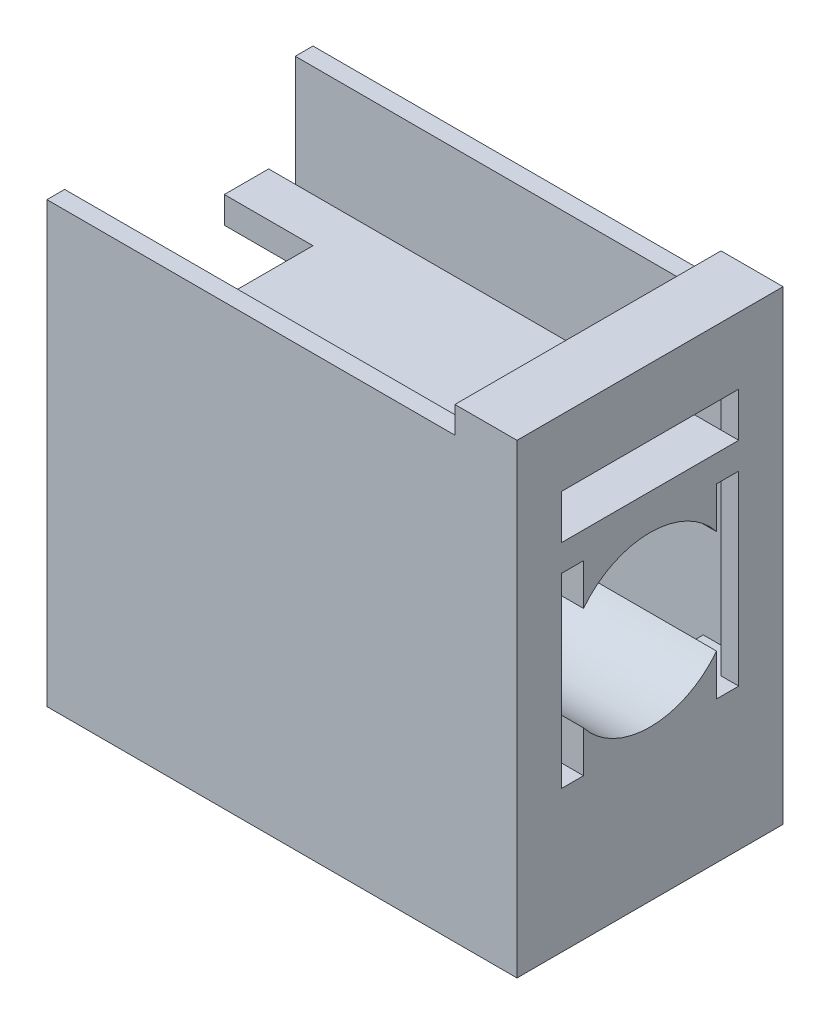
from build123d import *

# Parameters (mm, degrees)
SKETCH1_W            = 51
SKETCH1_H            = 2
SKETCH1_W_2          = 2
BOSS_EXTRUDE1_DEPTH  = 12.5
BOSS_EXTRUDE2_DEPTH  = 3
SKETCH3_W            = 20
SKETCH3_H            = 5
CUT_EXTRUDE1_DEPTH   = 3
SKETCH4_W            = 7
SKETCH4_H            = 30
BOSS_EXTRUDE3_DEPTH  = 3
SKETCH5_W            = 20
SKETCH5_H            = 22
SKETCH5_W_2          = 18
SKETCH5_H_2          = 20
BOSS_EXTRUDE4_DEPTH  = 43
SKETCH6_R            = 1.25
BOSS_EXTRUDE5_DEPTH  = 4.5
SKETCH8_W            = 53
SKETCH8_H            = 30
BOSS_EXTRUDE9_DEPTH  = 15
SKETCH8_6_W          = 2
SKETCH8_6_H          = 2
BOSS_EXTRUDE10_DEPTH = 22
SKETCH9_W            = 53
SKETCH9_H            = 30
BOSS_EXTRUDE11_DEPTH = 1
SKETCH10_W           = 20
SKETCH10_H           = 21
CUT_EXTRUDE2_DEPTH   = 59.677082571
BOSS_EXTRUDE14_DEPTH = 30
SKETCH14_R           = 1.5
SKETCH14_W           = 20.5
SKETCH14_H           = 3
CUT_EXTRUDE4_DEPTH   = 49.098856624


with BuildPart() as part:
    # Sketch1 → Boss-Extrude1 (new body)
    with BuildSketch(Plane(origin=(0, 0, 0), x_dir=(1, 0, 0), z_dir=(0, 1, 0))):
        with Locations((0, -14)):
            Rectangle(SKETCH1_W, SKETCH1_H)
        with Locations((26.5, -14)):
            Rectangle(SKETCH1_W_2, SKETCH1_H)
        Polygon((25.5, -10), (25.5, -13), (27.5, -13), (27.5, 13), (25.5, 13), (25.5, 10), align=None)
        with Locations((0, 14)):
            Rectangle(SKETCH1_W, SKETCH1_H)
        with Locations((26.5, 14)):
            Rectangle(SKETCH1_W_2, SKETCH1_H)
    extrude(amount=BOSS_EXTRUDE1_DEPTH)

    # Sketch1<3> → Boss-Extrude2 (add)
    with BuildSketch(Plane(origin=(0, 0, 0), x_dir=(1, 0, 0), z_dir=(0, 1, 0))):
        Polygon((-25.5, -5), (-25.5, -10), (25.5, -10), (25.5, 10), (-25.5, 10), (-25.5, 5), (-15.5, 5), (-15.5, -5), align=None)
    extrude(amount=BOSS_EXTRUDE2_DEPTH)

    # Sketch3 → Cut-Extrude1 (cut)
    with BuildSketch(Plane.ZY.offset(-25.5)):
        with Locations((0, 5.5)):
            Rectangle(SKETCH3_W, SKETCH3_H)
    extrude(amount=-CUT_EXTRUDE1_DEPTH, mode=Mode.SUBTRACT)

    # Sketch4 → Boss-Extrude3 (add)
    with BuildSketch(Plane(origin=(0, 12.5, 0), x_dir=(1, 0, 0), z_dir=(0, 1, 0))):
        with Locations((24, 0)):
            Rectangle(SKETCH4_W, SKETCH4_H)
    extrude(amount=BOSS_EXTRUDE3_DEPTH)

    # Sketch5 → Boss-Extrude4 (add)
    with BuildSketch(Plane(origin=(27.5, 0, 0), x_dir=(0, 0, -1), z_dir=(1, 0, 0))):
        with Locations((0, -11)):
            Rectangle(SKETCH5_W, SKETCH5_H)
        with Locations((0, -11)):
            Rectangle(SKETCH5_W_2, SKETCH5_H_2, mode=Mode.SUBTRACT)
    extrude(amount=-BOSS_EXTRUDE4_DEPTH)

    # Sketch6 → Boss-Extrude5 (add)
    with BuildSketch(Plane.XZ.offset(22)):
        with Locations(Location((9.5, 0, 0), (0, 0, 270))):
            Circle(SKETCH6_R)
    extrude(amount=BOSS_EXTRUDE5_DEPTH)



with BuildPart() as body_2:
    # Sketch8 → Boss-Extrude9 (new body)
    with BuildSketch(Plane.XZ.offset(22)):
        with Locations((1, 0)):
            Rectangle(SKETCH8_W, SKETCH8_H)
        with BuildLine():
            add(Edge.make_bspline(
                [(0, 13), (-23.5, 13), (-23.5, 0)],
                knots=[4.71238898, 4.71238898, 4.71238898, 6.283185307, 6.283185307, 6.283185307], degree=2, weights=[1, 0.707106781, 1]))
            Line((0, 13), (25.5, 13))
            Line((25.5, 13), (25.5, -13))
            Line((25.5, -13), (0, -13))
            add(Edge.make_bspline(
                [(-23.5, 0), (-23.5, -13), (0, -13)],
                knots=[0, 0, 0, 1.570796327, 1.570796327, 1.570796327], degree=2, weights=[1, 0.707106781, 1]))
        make_face(mode=Mode.SUBTRACT)
    extrude(amount=BOSS_EXTRUDE9_DEPTH)


with BuildPart() as part_1:
    add(part.part)

    add(body_2.part)  # Boss-Extrude10 merges body 2
    # Sketch8<6> → Boss-Extrude10 (add)
    with BuildSketch(Plane.XZ.offset(22)):
        Polygon((-23.5, -15), (25.5, -15), (25.5, -13), (0, -13), (-23.5, -13), align=None)
        Polygon((25.5, 13), (25.5, 15), (-23.5, 15), (-23.5, 13), (0, 13), align=None)
        with Locations((-24.5, -14)):
            Rectangle(SKETCH8_6_W, SKETCH8_6_H)
        with Locations((-24.5, 14)):
            Rectangle(SKETCH8_6_W, SKETCH8_6_H)
        Polygon((27.5, 10), (27.5, 15), (25.5, 15), (25.5, 13), (25.5, 10), align=None)
        Polygon((27.5, -15), (27.5, -10), (25.5, -10), (25.5, -13), (25.5, -15), align=None)
    extrude(amount=-BOSS_EXTRUDE10_DEPTH)

    # Sketch9 → Boss-Extrude11 (add)
    with BuildSketch(Plane.XZ.offset(22)):
        with Locations((1, 0)):
            Rectangle(SKETCH9_W, SKETCH9_H)
    extrude(amount=-BOSS_EXTRUDE11_DEPTH)

    # Sketch10 → Cut-Extrude2 (cut, through all)
    with BuildSketch(Plane.ZY.offset(15.5)):
        with Locations((0, -10.5)):
            Rectangle(SKETCH10_W, SKETCH10_H)
    extrude(amount=-CUT_EXTRUDE2_DEPTH, mode=Mode.SUBTRACT)

    # Sketch12 → Boss-Extrude14 (add)
    with BuildSketch(Plane(origin=(27.5, 0, 0), x_dir=(0, 0, -1), z_dir=(1, 0, 0))):
        with BuildLine():
            Line((-7.5, 0), (-7.5, -4.669048105))
            ThreePointArc((-7.5, -4.669048105), (0, -1), (7.5, -4.669048105))
            Line((7.5, -4.669048105), (7.5, 0))
            Line((7.5, 0), (-7.5, 0))
        make_face()
        with BuildLine():
            Line((-7.5, -16.330951895), (-7.5, -21))
            Line((-7.5, -21), (7.5, -21))
            Line((7.5, -21), (7.5, -16.330951895))
            ThreePointArc((7.5, -16.330951895), (0, -20), (-7.5, -16.330951895))
        make_face()
    extrude(amount=-BOSS_EXTRUDE14_DEPTH)

    # Sketch14 → Cut-Extrude4 (cut, through all)
    with BuildSketch(Plane(origin=(0, -21, 0), x_dir=(1, 0, 0), z_dir=(0, 1, 0))):
        with Locations((0, 11.5)):
            Circle(SKETCH14_R)
        with Locations((10.25, 11.5)):
            Rectangle(SKETCH14_W, SKETCH14_H)
    extrude(amount=-CUT_EXTRUDE4_DEPTH, mode=Mode.SUBTRACT)


solid = part_1.part
